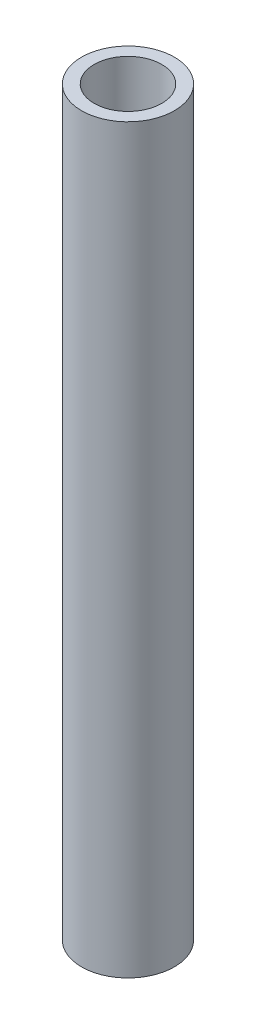
from build123d import *

# Parameters (mm, degrees)
SKETCH1_R           = 33.401
SKETCH1_R_2         = 24.3078
BOSS_EXTRUDE1_DEPTH = 266.7


with BuildPart() as part:
    # Sketch1 → Boss-Extrude1 (new, symmetric)
    with BuildSketch(Plane(origin=(0, 0, 0), x_dir=(1, 0, 0), z_dir=(0, 1, 0))):
        with Locations(Location((0, 0, 0), (0, 0, 270))):
            Circle(SKETCH1_R)
        with Locations(Location((0, 0, 0), (0, 0, 270))):
            Circle(SKETCH1_R_2, mode=Mode.SUBTRACT)
    extrude(amount=BOSS_EXTRUDE1_DEPTH, both=True)


solid = part.part
